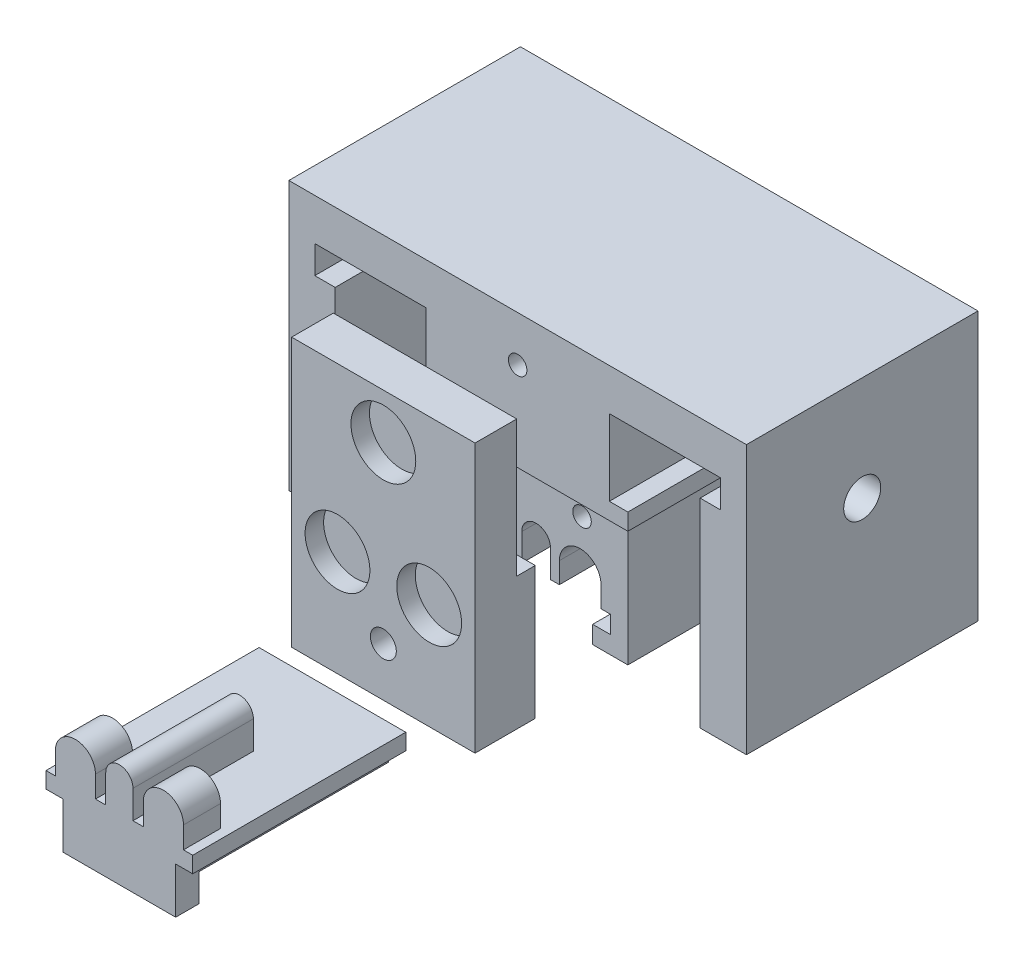
from build123d import *

# Parameters (mm, degrees)
BOSS_EXTRUDE1_DEPTH     = 25
SKETCH2_R               = 2
CUT_EXTRUDE1_DEPTH      = 58.232945058
CUT_EXTRUDE2_DEPTH      = 6
CUT_EXTRUDE2_DEPTH_BACK = 6
SKETCH6_W               = 6
SKETCH6_H               = 7.1
CUT_EXTRUDE3_DEPTH      = 10.450407
CUT_EXTRUDE4_REACH      = 40.018
CUT_EXTRUDE5_DEPTH      = 23
SKETCH12_W              = 19.8
SKETCH12_H              = 14.5
CUT_EXTRUDE6_DEPTH      = 2
CUT_EXTRUDE7_DEPTH      = 2
CUT_EXTRUDE7_DEPTH_BACK = 12
SKETCH13_R              = 1
SKETCH14_W              = 19.8
SKETCH14_H              = 29
SKETCH14_R              = 1.25
BOSS_EXTRUDE2_DEPTH     = 4.5
SKETCH15_W              = 19.8
SKETCH15_H              = 14.3
SKETCH15_R              = 1.25
BOSS_EXTRUDE3_DEPTH     = 2
SKETCH16_R              = 3.5
CUT_EXTRUDE8_DEPTH      = 2
SKETCH17_R              = 1.25
BOSS_EXTRUDE4_DEPTH     = 0.6
CUT_EXTRUDE9_DEPTH      = 2.6
SKETCH19_R              = 1.4
CUT_EXTRUDE10_DEPTH     = 3.9
BOSS_EXTRUDE5_DEPTH     = 23
SKETCH21_W              = 12.16
SKETCH21_H              = 2.5
BOSS_EXTRUDE6_DEPTH     = 3
CUT_EXTRUDE11_DEPTH     = 10
CUT_EXTRUDE12_DEPTH     = 9


with BuildPart() as part:
    # Sketch1 → Boss-Extrude1 (new body)
    with BuildSketch(Plane.XY):
        Polygon((-21.9, 7), (-21.9, 10), (-9.9, 10), (-9.9, 1.8), (-11.9, 1.8), (-11.9, 0), (-9.9, 0), (-9.9, -14.5), (9.9, -14.5), (9.9, 0), (11.9, 0), (11.9, 1.8), (9.9, 1.8), (9.9, 10), (21.9, 10), (21.9, 7), (19.7, 7), (19.7, -14.5), (24.7, -14.5), (24.7, 14.5), (-24.7, 14.5), (-24.7, -14.5), (-19.7, -14.5), (-19.7, 7), align=None)
    extrude(amount=BOSS_EXTRUDE1_DEPTH)

    # Sketch2 → Cut-Extrude1 (cut, through all)
    with BuildSketch(Plane.ZY.offset(24.7)):
        with Locations((12.5, 3.25)):
            Circle(SKETCH2_R)
    extrude(amount=-CUT_EXTRUDE1_DEPTH, mode=Mode.SUBTRACT)

    # Sketch5 → Cut-Extrude2 (cut, two sides: drawn at the far end of the back side and taken through both)
    with BuildSketch(Plane(origin=(0, 0, 0), x_dir=(0, 0, -1), z_dir=(1, 0, 0)).offset(-CUT_EXTRUDE2_DEPTH_BACK)):
        Polygon((-8.400813089, 3.25), (-10.450406544, 6.8), (-14.549593456, 6.8), (-16.599186911, 3.25), (-14.549593456, -0.3), (-10.450406544, -0.3), align=None)
    extrude(amount=CUT_EXTRUDE2_DEPTH + CUT_EXTRUDE2_DEPTH_BACK, mode=Mode.SUBTRACT)

    # Sketch6 → Cut-Extrude3 (cut)
    with BuildSketch(Plane.XY):
        with Locations((0, 3.25)):
            Rectangle(SKETCH6_W, SKETCH6_H)
    extrude(amount=CUT_EXTRUDE3_DEPTH, mode=Mode.SUBTRACT)

    # Sketch9 → Cut-Extrude4 (cut, up to next)
    with BuildSketch(Plane.XY.offset(25), mode=Mode.PRIVATE) as cut_extrude4_sk1:
        Polygon((-6.1, -14.5), (6.1, -14.5), (6.1, -12.6), (8, -12.6), (8, -10.7), (-8, -10.7), (-8, -12.6), (-6.1, -12.6), align=None)
    cut_extrude4_tool1 = extrude(cut_extrude4_sk1.sketch, amount=-CUT_EXTRUDE4_REACH, mode=Mode.PRIVATE) & part.part
    add(cut_extrude4_tool1.solids().sort_by_distance((0, -12.471986, 25))[0], mode=Mode.SUBTRACT)

    # Sketch11 → Cut-Extrude5 (cut)
    with BuildSketch(Plane.XY.offset(25)):
        with BuildLine():
            Line((-7, -8.45), (-7, -10.7))
            Line((-7, -10.7), (-2.5, -10.7))
            Line((-2.5, -10.7), (-2.5, -8.45))
            ThreePointArc((-2.5, -8.45), (-4.75, -6.2), (-7, -8.45))
        make_face()
        with BuildLine():
            Line((2.5, -8.45), (2.5, -10.7))
            Line((2.5, -10.7), (7, -10.7))
            Line((7, -10.7), (7, -8.45))
            ThreePointArc((7, -8.45), (4.75, -6.2), (2.5, -8.45))
        make_face()
        with BuildLine():
            Line((-1.55, -7.75), (-1.55, -10.7))
            Line((-1.55, -10.7), (1.55, -10.7))
            Line((1.55, -10.7), (1.55, -7.75))
            ThreePointArc((1.55, -7.75), (0, -6.2), (-1.55, -7.75))
        make_face()
    extrude(amount=-CUT_EXTRUDE5_DEPTH, mode=Mode.SUBTRACT)

    # Sketch12 → Cut-Extrude6 (cut)
    with BuildSketch(Plane.XY.offset(25)):
        with Locations((0, -7.25)):
            Rectangle(SKETCH12_W, SKETCH12_H)
    extrude(amount=-CUT_EXTRUDE6_DEPTH, mode=Mode.SUBTRACT)

    # Sketch13 → Cut-Extrude7 (cut, two sides: drawn at the far end of the back side and taken through both)
    with BuildSketch(Plane.XY.offset(23).offset(-CUT_EXTRUDE7_DEPTH_BACK)):
        with Locations((-4.95, -3.1)):
            Circle(SKETCH13_R)
        with Locations((4.95, -3.1)):
            Circle(SKETCH13_R)
        with Locations((0, 9.6)):
            Circle(SKETCH13_R)
    extrude(amount=CUT_EXTRUDE7_DEPTH + CUT_EXTRUDE7_DEPTH_BACK, mode=Mode.SUBTRACT)


with BuildPart() as body_2:
    # Sketch14 → Boss-Extrude2 (new body)
    with BuildSketch(Plane.XY.offset(35)):
        Rectangle(SKETCH14_W, SKETCH14_H)
        with Locations((0, 9.6)):
            Circle(SKETCH14_R, mode=Mode.SUBTRACT)
        with Locations((-4.95, -3.1)):
            Circle(SKETCH14_R, mode=Mode.SUBTRACT)
        with Locations((4.95, -3.1)):
            Circle(SKETCH14_R, mode=Mode.SUBTRACT)
    extrude(amount=BOSS_EXTRUDE2_DEPTH)

    # Sketch15 → Boss-Extrude3 (add)
    with BuildSketch(Plane(origin=(0, 0, 35), x_dir=(-1, 0, 0), z_dir=(0, 0, -1))):
        with Locations((0, -7.35)):
            Rectangle(SKETCH15_W, SKETCH15_H)
        with Locations((4.95, -3.1)):
            Circle(SKETCH15_R, mode=Mode.SUBTRACT)
        with Locations((-4.95, -3.1)):
            Circle(SKETCH15_R, mode=Mode.SUBTRACT)
    extrude(amount=BOSS_EXTRUDE3_DEPTH)

    # Sketch16 → Cut-Extrude8 (cut)
    with BuildSketch(Plane.XY.offset(39.5)):
        with Locations((4.95, -3.1)):
            Circle(SKETCH16_R)
        with Locations((-4.95, -3.1)):
            Circle(SKETCH16_R)
        with Locations((0, 9.6)):
            Circle(SKETCH16_R)
    extrude(amount=-CUT_EXTRUDE8_DEPTH, mode=Mode.SUBTRACT)

    # Sketch17 → Boss-Extrude4 (add)
    with BuildSketch(Plane.XY.offset(37.5)):
        with Locations((0, 9.6)):
            Circle(SKETCH17_R)
        with Locations(Location((-4.95, -3.1, 0), (0, 0, 180))):
            Circle(SKETCH17_R)
        with Locations(Location((4.95, -3.1, 0), (0, 0, 180))):
            Circle(SKETCH17_R)
    extrude(amount=-BOSS_EXTRUDE4_DEPTH)

    # Sketch18 → Cut-Extrude9 (cut)
    with BuildSketch(Plane(origin=(0, 0, 33), x_dir=(-1, 0, 0), z_dir=(0, 0, -1))):
        Polygon((-3.175426481, -9.225), (-1.58771324, -11.975), (1.58771324, -11.975), (3.175426481, -9.225), (1.58771324, -6.475), (-1.58771324, -6.475), align=None)
    extrude(amount=-CUT_EXTRUDE9_DEPTH, mode=Mode.SUBTRACT)

    # Sketch19 → Cut-Extrude10 (cut)
    with BuildSketch(Plane(origin=(0, 0, 35.6), x_dir=(-1, 0, 0), z_dir=(0, 0, -1))):
        with Locations((0, -9.225)):
            Circle(SKETCH19_R)
    extrude(amount=-CUT_EXTRUDE10_DEPTH, mode=Mode.SUBTRACT)


with BuildPart() as body_3:
    # Sketch20 → Boss-Extrude5 (new body)
    with BuildSketch(Plane.XY.offset(45)):
        with BuildLine():
            Line((-6.08, -12.52), (-7.92, -12.52))
            Line((-7.92, -12.52), (-7.92, -10.78))
            Line((-7.92, -10.78), (-6.92, -10.78))
            Line((-6.92, -10.78), (-6.92, -8.45))
            ThreePointArc((-6.92, -8.45), (-4.75, -6.28), (-2.58, -8.45))
            Line((-2.58, -8.45), (-2.58, -10.78))
            Line((-2.58, -10.78), (-1.47, -10.78))
            Line((-1.47, -10.78), (-1.47, -7.75))
            ThreePointArc((-1.47, -7.75), (0, -6.28), (1.47, -7.75))
            Line((1.47, -7.75), (1.47, -10.78))
            Line((1.47, -10.78), (2.58, -10.78))
            Line((2.58, -10.78), (2.58, -8.45))
            ThreePointArc((2.58, -8.45), (4.75, -6.28), (6.92, -8.45))
            Line((6.92, -8.45), (6.92, -10.78))
            Line((6.92, -10.78), (7.92, -10.78))
            Line((7.92, -10.78), (7.92, -12.52))
            Line((7.92, -12.52), (6.08, -12.52))
            Line((6.08, -12.52), (6.08, -14.5))
            Line((6.08, -14.5), (-6.08, -14.5))
            Line((-6.08, -14.5), (-6.08, -12.52))
        make_face()
    extrude(amount=BOSS_EXTRUDE5_DEPTH)

    # Sketch21 → Boss-Extrude6 (add)
    with BuildSketch(Plane.XZ.offset(14.5)):
        with Locations((0, 66.75)):
            Rectangle(SKETCH21_W, SKETCH21_H)
    extrude(amount=BOSS_EXTRUDE6_DEPTH)

    # Sketch22 → Cut-Extrude11 (cut)
    with BuildSketch(Plane(origin=(0, 0, 45), x_dir=(-1, 0, 0), z_dir=(0, 0, -1))):
        with BuildLine():
            Line((2.58, -10.78), (6.92, -10.78))
            Line((6.92, -10.78), (6.92, -8.45))
            ThreePointArc((6.92, -8.45), (4.75, -6.28), (2.58, -8.45))
            Line((2.58, -8.45), (2.58, -10.78))
        make_face()
        with BuildLine():
            Line((-1.47, -10.78), (1.47, -10.78))
            Line((1.47, -10.78), (1.47, -7.75))
            ThreePointArc((1.47, -7.75), (0, -6.28), (-1.47, -7.75))
            Line((-1.47, -7.75), (-1.47, -10.78))
        make_face()
        with BuildLine():
            Line((-6.92, -10.78), (-2.58, -10.78))
            Line((-2.58, -10.78), (-2.58, -8.45))
            ThreePointArc((-2.58, -8.45), (-4.75, -6.28), (-6.92, -8.45))
            Line((-6.92, -8.45), (-6.92, -10.78))
        make_face()
    extrude(amount=-CUT_EXTRUDE11_DEPTH, mode=Mode.SUBTRACT)

    # Sketch23 → Cut-Extrude12 (cut)
    with BuildSketch(Plane(origin=(0, 0, 55), x_dir=(-1, 0, 0), z_dir=(0, 0, -1))):
        with BuildLine():
            Line((-6.92, -10.78), (-2.58, -10.78))
            Line((-2.58, -10.78), (-2.58, -8.45))
            ThreePointArc((-2.58, -8.45), (-4.75, -6.28), (-6.92, -8.45))
            Line((-6.92, -8.45), (-6.92, -10.78))
        make_face()
        with BuildLine():
            Line((2.58, -10.78), (6.92, -10.78))
            Line((6.92, -10.78), (6.92, -8.45))
            ThreePointArc((6.92, -8.45), (4.75, -6.28), (2.58, -8.45))
            Line((2.58, -8.45), (2.58, -10.78))
        make_face()
    extrude(amount=-CUT_EXTRUDE12_DEPTH, mode=Mode.SUBTRACT)


solid = Compound([part.part, body_2.part, body_3.part])
